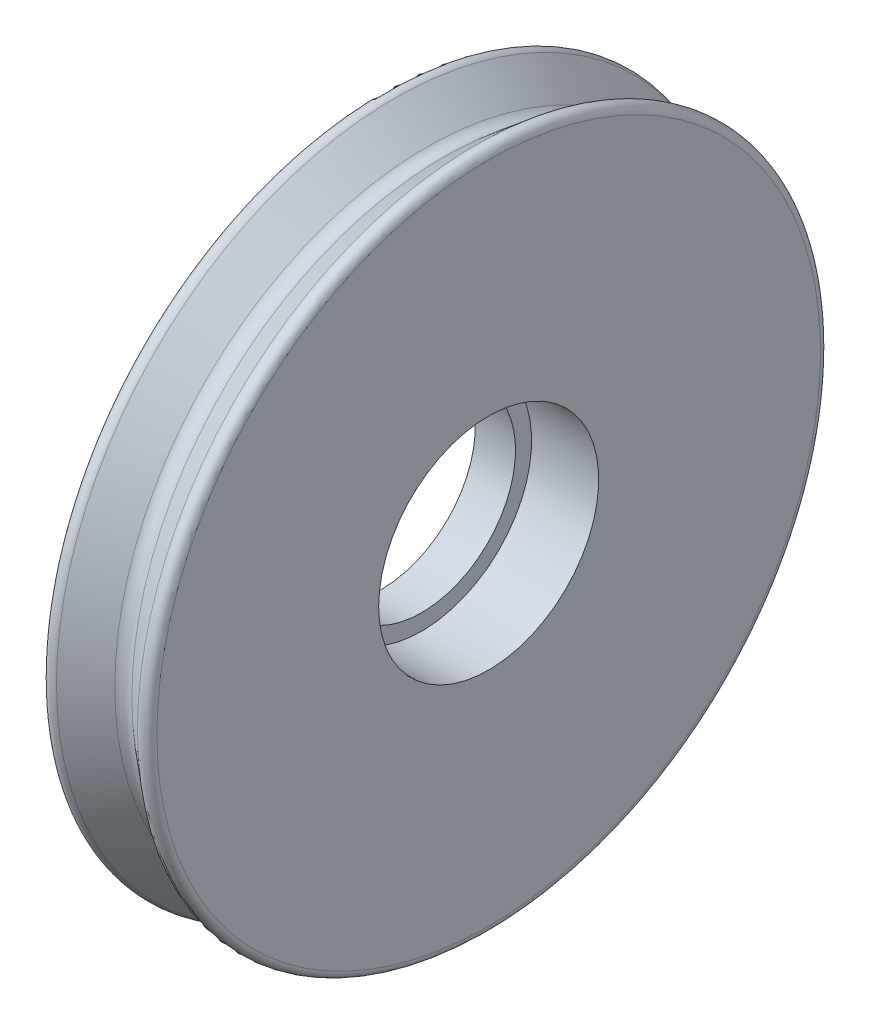
from build123d import *

# Parameters (mm, degrees)
FILLET1_R = 0.3


with BuildPart() as part:
    # Sketch1 → Revolve1 (revolve)
    with BuildSketch(Plane.XY, mode=Mode.PRIVATE) as revolve1_sk:
        with BuildLine():
            Line((0, 3.5), (0, 13))
            Line((0, 13), (1.682055053, 11.614110106))
            ThreePointArc((1.682055053, 11.614110106), (2, 11.5), (2.317944947, 11.614110106))
            Line((2.317944947, 11.614110106), (4, 13))
            Line((4, 13), (4, 4.1))
            Line((4, 4.1), (1.5, 4.1))
            Line((1.5, 4.1), (1.5, 3.5))
            Line((1.5, 3.5), (0, 3.5))
        make_face()
    revolve(revolve1_sk.sketch.rotate(Axis((0, 0, 0), (1, 0, 0)), 90), axis=Axis((0, 0, 0), (1, 0, 0)))

    # Fillet1
    fillet1_edges = [part.edges().sort_by_distance(p)[0] for p in [
        (0, 0, -13),
        (4, 0, -13),
    ]]
    fillet(fillet1_edges, radius=FILLET1_R)


solid = part.part
